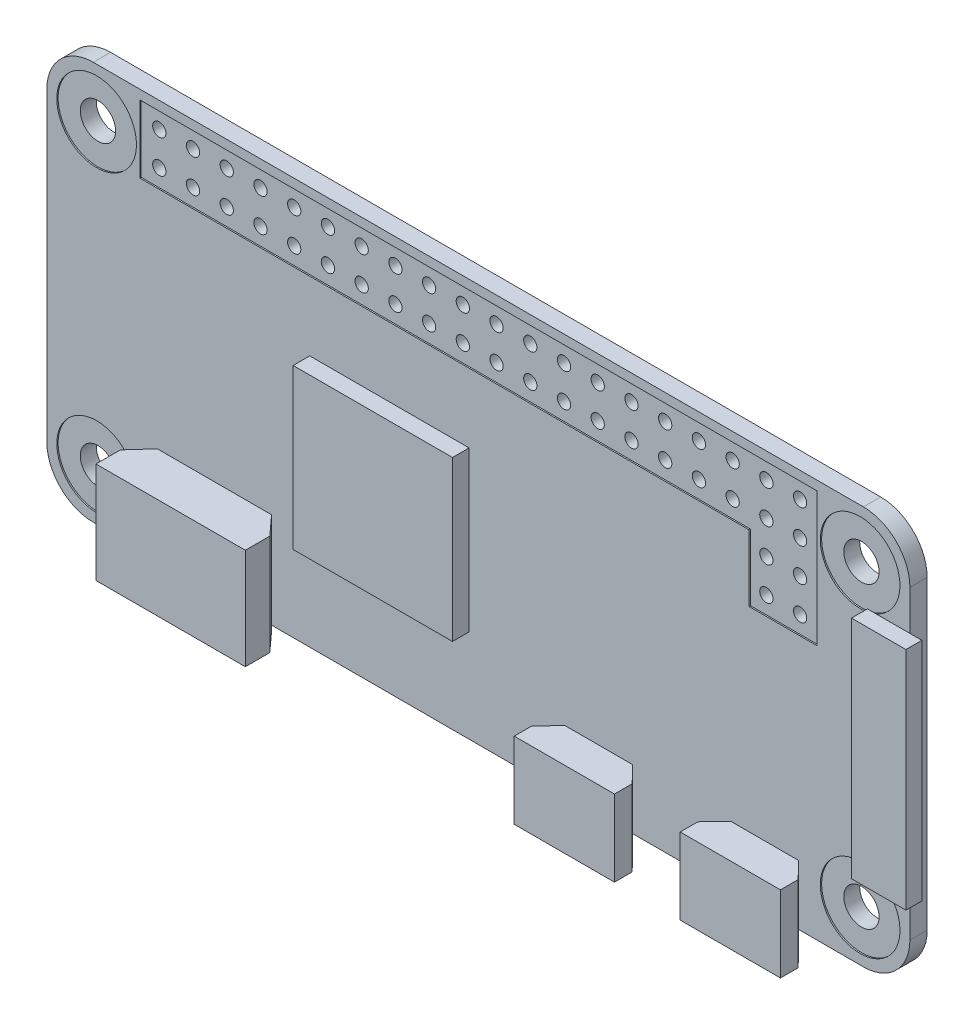
from build123d import *

# Parameters (mm, degrees)
BOSS_EXTRUDE1_DEPTH     = 1.3
SKETCH2_R               = 1.33
CUT_EXTRUDE1_DEPTH      = 36.818151823
MIRROR2_COPY_1_SKETCH_R = 1.33
MIRROR2_COPY_1_DEPTH    = 36.818151823
CUT_EXTRUDE2_DEPTH      = 0.1
SKETCH4_R               = 0.5
CUT_EXTRUDE3_DEPTH      = 36.814661802
LPATTERN1_COUNT         = 20
LPATTERN1_PITCH         = 2.54
LPATTERN1_COUNT_DIR2    = 2
LPATTERN1_PITCH_DIR2    = 2.5
SKETCH5_R               = 0.5
CUT_EXTRUDE4_DEPTH      = 36.814661802
LPATTERN2_COUNT         = 2
LPATTERN2_PITCH         = 2.54
LPATTERN2_COUNT_DIR2    = 2
LPATTERN2_PITCH_DIR2    = 2.5
SKETCH7_R               = 3
CUT_EXTRUDE5_DEPTH      = 0.1
MIRROR4_COPY_1_SKETCH_R = 3
MIRROR4_COPY_1_DEPTH    = 0.1
SKETCH8_W               = 12
SKETCH8_H               = 12
BOSS_EXTRUDE2_DEPTH     = 1.25
BOSS_EXTRUDE3_START     = -7.8
BOSS_EXTRUDE3_DEPTH     = 7.6
CUT_EXTRUDE6_DEPTH      = 7.25
BOSS_EXTRUDE4_START     = -10.5
BOSS_EXTRUDE4_DEPTH     = 5.75
CUT_EXTRUDE7_DEPTH      = 5.4
LPATTERN3_COUNT         = 2
LPATTERN3_PITCH         = 12.5
BOSS_EXTRUDE5_START     = 29.3
SKETCH14_W              = 1.2
SKETCH14_H              = 17
BOSS_EXTRUDE5_DEPTH     = 4.1


with BuildPart() as part:
    # Sketch1 → Boss-Extrude1 (new body)
    with BuildSketch(Plane.XY):
        with BuildLine():
            Line((-29, -15), (29, -15))
            ThreePointArc((29, -15), (31.474873734, -13.974873734), (32.5, -11.5))
            Line((32.5, -11.5), (32.5, 11.5))
            ThreePointArc((32.5, 11.5), (31.474873734, 13.974873734), (29, 15))
            Line((29, 15), (-29, 15))
            ThreePointArc((-29, 15), (-31.474873734, 13.974873734), (-32.5, 11.5))
            Line((-32.5, 11.5), (-32.5, -11.5))
            ThreePointArc((-32.5, -11.5), (-31.474873734, -13.974873734), (-29, -15))
        make_face()
    extrude(amount=BOSS_EXTRUDE1_DEPTH)

    # Sketch2 → Cut-Extrude1 (cut, through all)
    with BuildSketch(Plane.XY.offset(1.3)):
        with Locations((-28.75, 11.25)):
            Circle(SKETCH2_R)
    cut_extrude1 = extrude(amount=-CUT_EXTRUDE1_DEPTH, mode=Mode.SUBTRACT)

    # Mirror1: Cut-Extrude1 across plane
    add(cut_extrude1.mirror(Plane.ZX), mode=Mode.SUBTRACT)

    # Mirror2: Cut-Extrude1 across plane
    add(cut_extrude1.mirror(Plane(origin=(0, 0, 0), x_dir=(0, 0, 1), z_dir=(1, 0, 0))), mode=Mode.SUBTRACT)

    # Mirror2 copy 1 sketch → Mirror2 copy 1 (cut, through all)
    with BuildSketch(Plane(origin=(0, 0, 1.3), x_dir=(-1, 0, 0), z_dir=(0, 0, 1))):
        with Locations((-28.75, 11.25)):
            Circle(MIRROR2_COPY_1_SKETCH_R)
    extrude(amount=-MIRROR2_COPY_1_DEPTH, mode=Mode.SUBTRACT)

    # Sketch3 → Cut-Extrude2 (cut)
    with BuildSketch(Plane.XY.offset(1.3)):
        Polygon((-25.5, 14.3), (25.5, 14.3), (25.5, 4.2), (20.4, 4.2), (20.4, 9.2), (-25.5, 9.2), align=None)
    extrude(amount=-CUT_EXTRUDE2_DEPTH, mode=Mode.SUBTRACT)

    # Sketch4 → Cut-Extrude3 (cut, through all)
    with BuildSketch(Plane.XY.offset(1.2)):
        with Locations((-24.13, 13)):
            Circle(SKETCH4_R)
    cut_extrude3 = extrude(amount=-CUT_EXTRUDE3_DEPTH, mode=Mode.SUBTRACT)

    # LPattern1: Cut-Extrude3 20 × 2
    with Locations(*[(i * LPATTERN1_PITCH, -j * LPATTERN1_PITCH_DIR2, 0) for i in range(LPATTERN1_COUNT) for j in range(LPATTERN1_COUNT_DIR2) if (i, j) != (0, 0)]):
        add(cut_extrude3, mode=Mode.SUBTRACT)

    # Sketch5 → Cut-Extrude4 (cut, through all)
    with BuildSketch(Plane.XY.offset(1.2)):
        with Locations((21.59, 8)):
            Circle(SKETCH5_R)
    cut_extrude4 = extrude(amount=-CUT_EXTRUDE4_DEPTH, mode=Mode.SUBTRACT)

    # LPattern2: Cut-Extrude4 2 × 2
    with Locations(*[(i * LPATTERN2_PITCH, -j * LPATTERN2_PITCH_DIR2, 0) for i in range(LPATTERN2_COUNT) for j in range(LPATTERN2_COUNT_DIR2) if (i, j) != (0, 0)]):
        add(cut_extrude4, mode=Mode.SUBTRACT)

    # Sketch7 → Cut-Extrude5 (cut)
    with BuildSketch(Plane.XY.offset(1.3)):
        with Locations((-28.75, 11.25)):
            Circle(SKETCH7_R)
    cut_extrude5 = extrude(amount=-CUT_EXTRUDE5_DEPTH, mode=Mode.SUBTRACT)

    # Mirror3: Cut-Extrude5 across plane
    add(cut_extrude5.mirror(Plane.ZX), mode=Mode.SUBTRACT)

    # Mirror4: Cut-Extrude5 across plane
    add(cut_extrude5.mirror(Plane(origin=(0, 0, 0), x_dir=(0, 0, 1), z_dir=(1, 0, 0))), mode=Mode.SUBTRACT)

    # Mirror4 copy 1 sketch → Mirror4 copy 1 (cut)
    with BuildSketch(Plane(origin=(0, 0, 1.3), x_dir=(-1, 0, 0), z_dir=(0, 0, 1))):
        with Locations((-28.75, 11.25)):
            Circle(MIRROR4_COPY_1_SKETCH_R)
    extrude(amount=-MIRROR4_COPY_1_DEPTH, mode=Mode.SUBTRACT)

    # Sketch8 → Boss-Extrude2 (add)
    with BuildSketch(Plane.XY.offset(1.3)):
        with Locations((-6.7, -2)):
            Rectangle(SKETCH8_W, SKETCH8_H)
    extrude(amount=BOSS_EXTRUDE2_DEPTH)

    # Sketch9 → Boss-Extrude3 (add)
    with BuildSketch(Plane(origin=(0, 0, 0), x_dir=(1, 0, 0), z_dir=(0, 1, 0)).offset(BOSS_EXTRUDE3_START)):
        Polygon((-24.175, -1.3), (-15.575, -1.3), (-14.25, -2.76), (-14.25, -4.6), (-25.5, -4.6), (-25.5, -2.76), align=None)
    extrude(amount=-BOSS_EXTRUDE3_DEPTH)

    # Sketch10 → Cut-Extrude6 (cut)
    with BuildSketch(Plane.XZ.offset(15.4)):
        Polygon((-14.6, 2.895140858), (-14.6, 4.25), (-25.15, 4.25), (-25.15, 2.895140858), (-24.01999203, 1.65), (-15.73000797, 1.65), align=None)
    extrude(amount=-CUT_EXTRUDE6_DEPTH, mode=Mode.SUBTRACT)

    # Sketch12 → Boss-Extrude4 (add)
    with BuildSketch(Plane(origin=(0, 0, 0), x_dir=(1, 0, 0), z_dir=(0, 1, 0)).offset(BOSS_EXTRUDE4_START)):
        Polygon((17.8, -3.9), (25.35, -3.9), (25.35, -2.57), (24.125, -1.3), (19.025, -1.3), (17.8, -2.57), align=None)
    boss_extrude4 = extrude(amount=-BOSS_EXTRUDE4_DEPTH)

    # Sketch13 → Cut-Extrude7 (cut)
    with BuildSketch(Plane.XZ.offset(16.25)):
        Polygon((18.15, 3.55), (18.15, 2.711290957), (19.173686159, 1.65), (23.976313841, 1.65), (25, 2.711290957), (25, 3.55), align=None)
    cut_extrude7 = extrude(amount=-CUT_EXTRUDE7_DEPTH, mode=Mode.SUBTRACT)

    # LPattern3: Boss-Extrude4, Cut-Extrude7 ×2
    with Locations(*[(-i * LPATTERN3_PITCH, 0, 0) for i in range(1, LPATTERN3_COUNT)]):
        add(boss_extrude4)
        add(cut_extrude7, mode=Mode.SUBTRACT)

    # Sketch14 → Boss-Extrude5 (add)
    with BuildSketch(Plane(origin=(0, 0, 0), x_dir=(0, 0, -1), z_dir=(1, 0, 0)).offset(BOSS_EXTRUDE5_START)):
        with Locations((-1.9, 0)):
            Rectangle(SKETCH14_W, SKETCH14_H)
    extrude(amount=BOSS_EXTRUDE5_DEPTH)


solid = part.part
